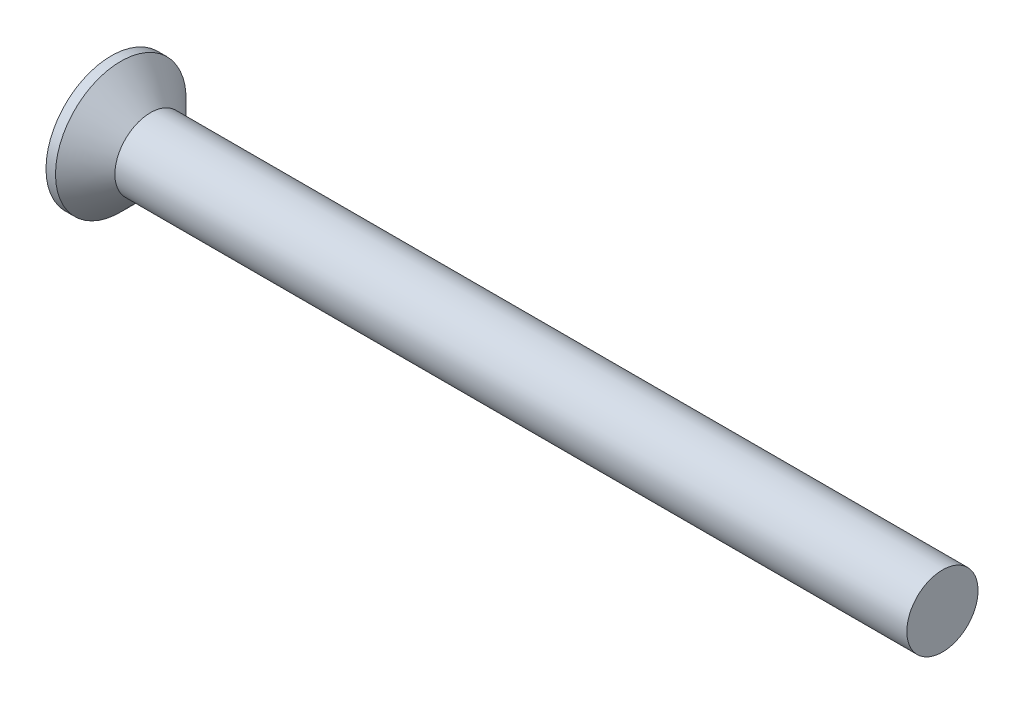
from build123d import *


with BuildPart() as part:
    # Esquisse1 → Révolution1 (revolve)
    with BuildSketch(Plane.XY, mode=Mode.PRIVATE) as r_volution1_sk:
        Polygon((0, 0), (35, 0), (35, 1.5), (1.65, 1.5), (0.4, 2.75), (0, 2.75), align=None)
    revolve(r_volution1_sk.sketch.rotate(Axis((0, 0, 0), (1, 0, 0)), 90), axis=Axis((0, 0, 0), (1, 0, 0)))


solid = part.part
